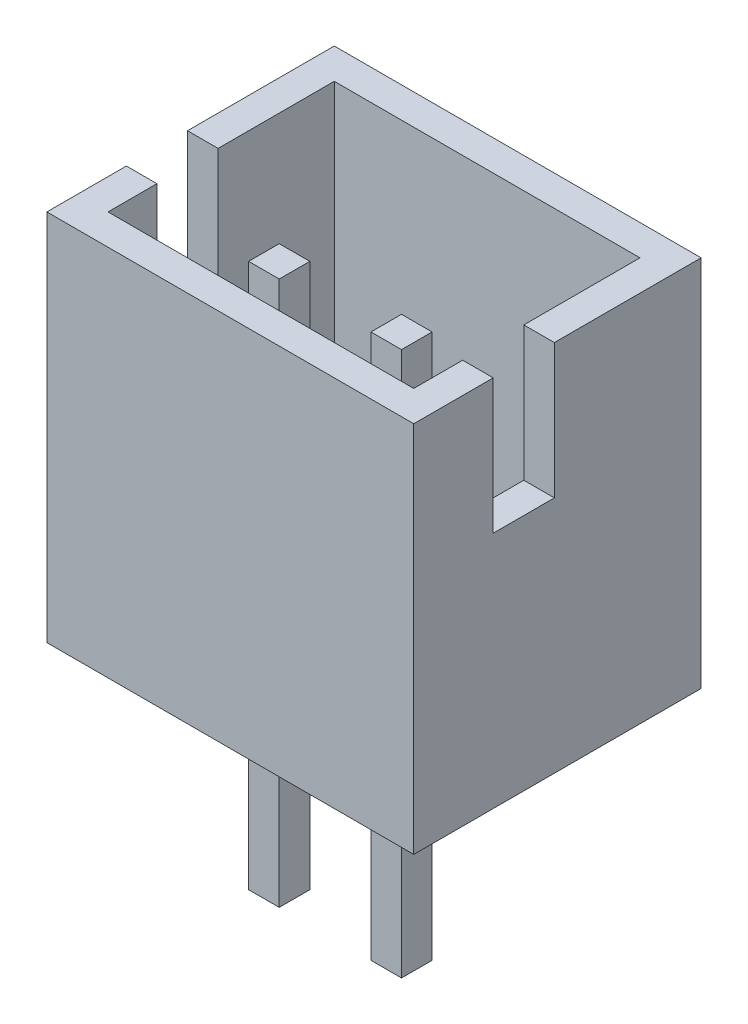
from build123d import *

# Parameters (mm, degrees)
SKETCH1_W                  = 6
SKETCH1_H                  = 4.7
BOSS_EXTRUDE1_DEPTH        = 6.1
SHELL1_T                   = -0.5
BOSS_EXTRUDE2_DEPTH        = 5
BOSS_EXTRUDE2_DEPTH_BACK   = 3.9
SKETCH2_W                  = 0.5
SKETCH2_H                  = 0.5
BOSS_EXTRUDE2_2_DEPTH      = 5
BOSS_EXTRUDE2_2_DEPTH_BACK = 3.9
SKETCH3_W                  = 1
SKETCH3_H                  = 2.2
CUT_EXTRUDE1_DEPTH         = 5.5


with BuildPart() as part:
    # Sketch1 → Boss-Extrude1 (new body)
    with BuildSketch(Plane(origin=(0, 0, 0), x_dir=(1, 0, 0), z_dir=(0, 1, 0))):
        Rectangle(SKETCH1_W, SKETCH1_H)
    extrude(amount=BOSS_EXTRUDE1_DEPTH)

    # Shell1
    shell1_openings = [part.faces().sort_by_distance(p)[0] for p in [
        (0, 6.1, 0),
    ]]
    offset(amount=SHELL1_T, openings=shell1_openings, kind=Kind.INTERSECTION)

    # Sketch3 → Cut-Extrude1 (cut)
    with BuildSketch(Plane.ZY.offset(3)):
        with Locations((0.55, 5)):
            Rectangle(SKETCH3_W, SKETCH3_H)
    cut_extrude1 = extrude(amount=-CUT_EXTRUDE1_DEPTH, mode=Mode.SUBTRACT)

    # Mirror1: Cut-Extrude1 across plane
    add(cut_extrude1.mirror(Plane(origin=(0, 0, 0), x_dir=(0, 0, 1), z_dir=(1, 0, 0))), mode=Mode.SUBTRACT)


with BuildPart() as body_2:
    # Sketch2 → Boss-Extrude2 (new, two sides: drawn at the far end of the back side and taken through both)
    with BuildSketch(Plane(origin=(0, 0.5, 0), x_dir=(1, 0, 0), z_dir=(0, 1, 0)).offset(-BOSS_EXTRUDE2_DEPTH_BACK)):
        with Locations((-1, -0.55)):
            Rectangle(SKETCH2_W, SKETCH2_H)
    extrude(amount=BOSS_EXTRUDE2_DEPTH + BOSS_EXTRUDE2_DEPTH_BACK)


with BuildPart() as body_3:
    # Sketch2 → Boss-Extrude2 2 (new, two sides: drawn at the far end of the back side and taken through both)
    with BuildSketch(Plane(origin=(0, 0.5, 0), x_dir=(1, 0, 0), z_dir=(0, 1, 0)).offset(-BOSS_EXTRUDE2_2_DEPTH_BACK)):
        with Locations((1, -0.55)):
            Rectangle(SKETCH2_W, SKETCH2_H)
    extrude(amount=BOSS_EXTRUDE2_2_DEPTH + BOSS_EXTRUDE2_2_DEPTH_BACK)


solid = Compound([part.part, body_2.part, body_3.part])
